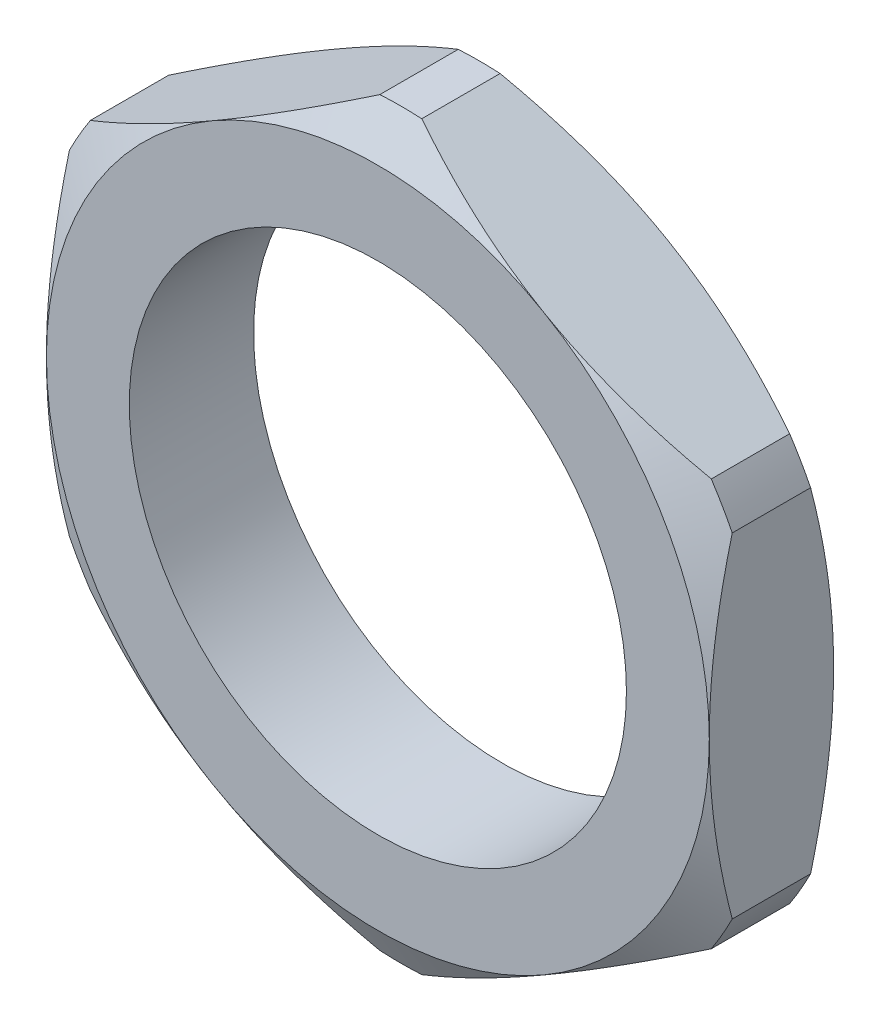
from build123d import *

# Parameters (mm, degrees)
CUT_EXTRUDE1_DEPTH      = 11.128113146
CUT_EXTRUDE1_DEPTH_BACK = 11.128113146
SKETCH4_OUTSIDE_W       = 20.276
SKETCH4_OUTSIDE_H       = 20.276


with BuildPart() as part:
    # Sketch3 → Revolve1 (revolve)
    with BuildSketch(Plane(origin=(0, 0, 0), x_dir=(0, 0, -1), z_dir=(1, 0, 0))):
        Polygon((-1.190625, 6.35), (-0.750684095, 7.112), (0.750684095, 7.112), (1.190625, 6.35), (1.190625, 4.7625), (-1.190625, 4.7625), align=None)
    revolve(axis=Axis((0, 0, 1.190625), (0, 0, -1)))

    # Sketch4 outside → Cut-Extrude1 (cut, two sides: drawn at the far end of the back side and taken through both)
    with BuildSketch(Plane.XY.offset(-CUT_EXTRUDE1_DEPTH_BACK)):
        Rectangle(SKETCH4_OUTSIDE_W, SKETCH4_OUTSIDE_H)
        Polygon((0, 7.332348419), (-6.35, 3.666174209), (-6.35, -3.666174209), (0, -7.332348419), (6.35, -3.666174209), (6.35, 3.666174209), align=None, mode=Mode.SUBTRACT)
    extrude(amount=CUT_EXTRUDE1_DEPTH + CUT_EXTRUDE1_DEPTH_BACK, mode=Mode.SUBTRACT)


solid = part.part
